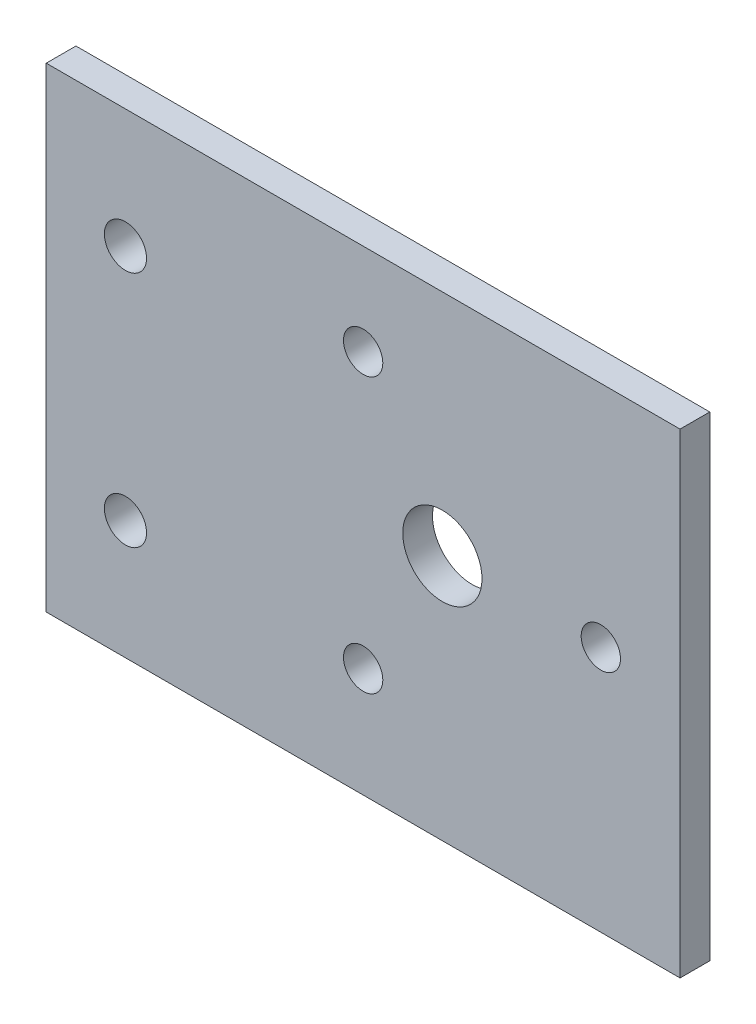
from build123d import *

# Parameters (mm, degrees)
SKETCH1_W           = 101.6
SKETCH1_H           = 76.2
BOSS_EXTRUDE1_DEPTH = 4.7625
SKETCH2_R           = 3.3782
CUT_EXTRUDE1_DEPTH  = 128.089265504
SKETCH3_R           = 6.35
SKETCH3_R_2         = 3.1500064
CUT_EXTRUDE2_DEPTH  = 128.089265504


with BuildPart() as part:
    # Sketch1 → Boss-Extrude1 (new body)
    with BuildSketch(Plane.XY):
        with Locations((50.8, 38.1)):
            Rectangle(SKETCH1_W, SKETCH1_H)
    extrude(amount=BOSS_EXTRUDE1_DEPTH)

    # Sketch2 → Cut-Extrude1 (cut, through all)
    with BuildSketch(Plane.XY.offset(4.7625)):
        with Locations((12.7, 57.15)):
            Circle(SKETCH2_R)
        with Locations((12.7, 19.05)):
            Circle(SKETCH2_R)
    extrude(amount=-CUT_EXTRUDE1_DEPTH, mode=Mode.SUBTRACT)

    # Sketch3 → Cut-Extrude2 (cut, through all)
    with BuildSketch(Plane.XY.offset(4.7625)):
        with Locations((63.5, 39.546877005)):
            Circle(SKETCH3_R)
        with Locations((50.8, 61.543922261)):
            Circle(SKETCH3_R_2)
        with Locations((88.9, 39.546877005)):
            Circle(SKETCH3_R_2)
        with Locations((50.8, 17.549831749)):
            Circle(SKETCH3_R_2)
    extrude(amount=-CUT_EXTRUDE2_DEPTH, mode=Mode.SUBTRACT)


solid = part.part
